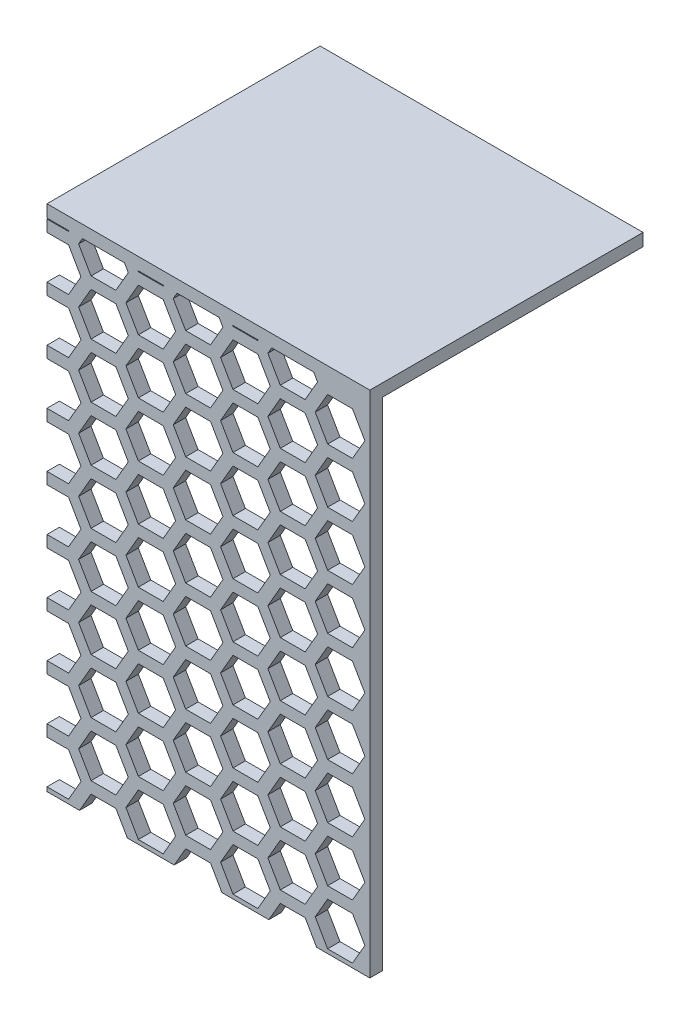
from build123d import *

# Parameters (mm, degrees)
SKETCH1_W                = 130
SKETCH1_H                = 205
BOSS_EXTRUDE1_DEPTH      = 5
CUT_EXTRUDE4_DEPTH       = 90
BOSS_EXTRUDE2_DEPTH      = 105
BOSS_EXTRUDE2_DEPTH_BACK = 5
SKETCH2_W                = 130
SKETCH2_H                = 5


with BuildPart() as part:
    # Sketch1 → Boss-Extrude1 (new body)
    with BuildSketch(Plane.XY):
        Rectangle(SKETCH1_W, SKETCH1_H)
    extrude(amount=BOSS_EXTRUDE1_DEPTH)

    # Sketch3 → Cut-Extrude4 (cut)
    with BuildSketch(Plane(origin=(0, 0, 5), x_dir=(-1, 0, 0), z_dir=(0, 0, -1))):
        Polygon((-43, 83.839745962), (-48, 92.5), (-58, 92.5), (-63, 83.839745962), (-58, 75.179491924), (-48, 75.179491924), align=None)
        Polygon((71.3153533, 149.839745962), (66.3153533, 158.5), (56.3153533, 158.5), (51.3153533, 149.839745962), (56.3153533, 141.179491924), (66.3153533, 141.179491924), align=None)
        Polygon((-23.947441117, 94.839745962), (-28.947441117, 103.5), (-38.947441117, 103.5), (-43.947441117, 94.839745962), (-38.947441117, 86.179491924), (-28.947441117, 86.179491924), align=None)
        Polygon((-4.894882233, 105.839745962), (-9.894882233, 114.5), (-19.894882233, 114.5), (-24.894882233, 105.839745962), (-19.894882233, 97.179491924), (-9.894882233, 97.179491924), align=None)
        Polygon((14.15767665, 116.839745962), (9.15767665, 125.5), (-0.84232335, 125.5), (-5.84232335, 116.839745962), (-0.84232335, 108.179491924), (9.15767665, 108.179491924), align=None)
        Polygon((33.210235533, 127.839745962), (28.210235533, 136.5), (18.210235533, 136.5), (13.210235533, 127.839745962), (18.210235533, 119.179491924), (28.210235533, 119.179491924), align=None)
        Polygon((52.262794416, 138.839745962), (47.262794416, 147.5), (37.262794416, 147.5), (32.262794416, 138.839745962), (37.262794416, 130.179491924), (47.262794416, 130.179491924), align=None)
        Polygon((-23.947441117, 72.839745962), (-28.947441117, 81.5), (-38.947441117, 81.5), (-43.947441117, 72.839745962), (-38.947441117, 64.179491924), (-28.947441117, 64.179491924), align=None)
        Polygon((-4.894882233, 83.839745962), (-9.894882233, 92.5), (-19.894882233, 92.5), (-24.894882233, 83.839745962), (-19.894882233, 75.179491924), (-9.894882233, 75.179491924), align=None)
        Polygon((14.15767665, 94.839745962), (9.15767665, 103.5), (-0.84232335, 103.5), (-5.84232335, 94.839745962), (-0.84232335, 86.179491924), (9.15767665, 86.179491924), align=None)
        Polygon((33.210235533, 105.839745962), (28.210235533, 114.5), (18.210235533, 114.5), (13.210235533, 105.839745962), (18.210235533, 97.179491924), (28.210235533, 97.179491924), align=None)
        Polygon((52.262794416, 116.839745962), (47.262794416, 125.5), (37.262794416, 125.5), (32.262794416, 116.839745962), (37.262794416, 108.179491924), (47.262794416, 108.179491924), align=None)
        Polygon((-23.947441117, 50.839745962), (-28.947441117, 59.5), (-38.947441117, 59.5), (-43.947441117, 50.839745962), (-38.947441117, 42.179491924), (-28.947441117, 42.179491924), align=None)
        Polygon((-4.894882233, 61.839745962), (-9.894882233, 70.5), (-19.894882233, 70.5), (-24.894882233, 61.839745962), (-19.894882233, 53.179491924), (-9.894882233, 53.179491924), align=None)
        Polygon((14.15767665, 72.839745962), (9.15767665, 81.5), (-0.84232335, 81.5), (-5.84232335, 72.839745962), (-0.84232335, 64.179491924), (9.15767665, 64.179491924), align=None)
        Polygon((33.210235533, 83.839745962), (28.210235533, 92.5), (18.210235533, 92.5), (13.210235533, 83.839745962), (18.210235533, 75.179491924), (28.210235533, 75.179491924), align=None)
        Polygon((52.262794416, 94.839745962), (47.262794416, 103.5), (37.262794416, 103.5), (32.262794416, 94.839745962), (37.262794416, 86.179491924), (47.262794416, 86.179491924), align=None)
        Polygon((-23.947441117, 28.839745962), (-28.947441117, 37.5), (-38.947441117, 37.5), (-43.947441117, 28.839745962), (-38.947441117, 20.179491924), (-28.947441117, 20.179491924), align=None)
        Polygon((-4.894882233, 39.839745962), (-9.894882233, 48.5), (-19.894882233, 48.5), (-24.894882233, 39.839745962), (-19.894882233, 31.179491924), (-9.894882233, 31.179491924), align=None)
        Polygon((14.15767665, 50.839745962), (9.15767665, 59.5), (-0.84232335, 59.5), (-5.84232335, 50.839745962), (-0.84232335, 42.179491924), (9.15767665, 42.179491924), align=None)
        Polygon((33.210235533, 61.839745962), (28.210235533, 70.5), (18.210235533, 70.5), (13.210235533, 61.839745962), (18.210235533, 53.179491924), (28.210235533, 53.179491924), align=None)
        Polygon((52.262794416, 72.839745962), (47.262794416, 81.5), (37.262794416, 81.5), (32.262794416, 72.839745962), (37.262794416, 64.179491924), (47.262794416, 64.179491924), align=None)
        Polygon((-23.947441117, 6.839745962), (-28.947441117, 15.5), (-38.947441117, 15.5), (-43.947441117, 6.839745962), (-38.947441117, -1.820508076), (-28.947441117, -1.820508076), align=None)
        Polygon((-4.894882233, 17.839745962), (-9.894882233, 26.5), (-19.894882233, 26.5), (-24.894882233, 17.839745962), (-19.894882233, 9.179491924), (-9.894882233, 9.179491924), align=None)
        Polygon((14.15767665, 28.839745962), (9.15767665, 37.5), (-0.84232335, 37.5), (-5.84232335, 28.839745962), (-0.84232335, 20.179491924), (9.15767665, 20.179491924), align=None)
        Polygon((33.210235533, 39.839745962), (28.210235533, 48.5), (18.210235533, 48.5), (13.210235533, 39.839745962), (18.210235533, 31.179491924), (28.210235533, 31.179491924), align=None)
        Polygon((52.262794416, 50.839745962), (47.262794416, 59.5), (37.262794416, 59.5), (32.262794416, 50.839745962), (37.262794416, 42.179491924), (47.262794416, 42.179491924), align=None)
        Polygon((-23.947441117, -15.160254038), (-28.947441117, -6.5), (-38.947441117, -6.5), (-43.947441117, -15.160254038), (-38.947441117, -23.820508076), (-28.947441117, -23.820508076), align=None)
        Polygon((-4.894882233, -4.160254038), (-9.894882233, 4.5), (-19.894882233, 4.5), (-24.894882233, -4.160254038), (-19.894882233, -12.820508076), (-9.894882233, -12.820508076), align=None)
        Polygon((14.15767665, 6.839745962), (9.15767665, 15.5), (-0.84232335, 15.5), (-5.84232335, 6.839745962), (-0.84232335, -1.820508076), (9.15767665, -1.820508076), align=None)
        Polygon((33.210235533, 17.839745962), (28.210235533, 26.5), (18.210235533, 26.5), (13.210235533, 17.839745962), (18.210235533, 9.179491924), (28.210235533, 9.179491924), align=None)
        Polygon((52.262794416, 28.839745962), (47.262794416, 37.5), (37.262794416, 37.5), (32.262794416, 28.839745962), (37.262794416, 20.179491924), (47.262794416, 20.179491924), align=None)
        Polygon((-23.947441117, -37.160254038), (-28.947441117, -28.5), (-38.947441117, -28.5), (-43.947441117, -37.160254038), (-38.947441117, -45.820508076), (-28.947441117, -45.820508076), align=None)
        Polygon((-4.894882233, -26.160254038), (-9.894882233, -17.5), (-19.894882233, -17.5), (-24.894882233, -26.160254038), (-19.894882233, -34.820508076), (-9.894882233, -34.820508076), align=None)
        Polygon((14.15767665, -15.160254038), (9.15767665, -6.5), (-0.84232335, -6.5), (-5.84232335, -15.160254038), (-0.84232335, -23.820508076), (9.15767665, -23.820508076), align=None)
        Polygon((33.210235533, -4.160254038), (28.210235533, 4.5), (18.210235533, 4.5), (13.210235533, -4.160254038), (18.210235533, -12.820508076), (28.210235533, -12.820508076), align=None)
        Polygon((52.262794416, 6.839745962), (47.262794416, 15.5), (37.262794416, 15.5), (32.262794416, 6.839745962), (37.262794416, -1.820508076), (47.262794416, -1.820508076), align=None)
        Polygon((-23.947441117, -59.160254038), (-28.947441117, -50.5), (-38.947441117, -50.5), (-43.947441117, -59.160254038), (-38.947441117, -67.820508076), (-28.947441117, -67.820508076), align=None)
        Polygon((-4.894882233, -48.160254038), (-9.894882233, -39.5), (-19.894882233, -39.5), (-24.894882233, -48.160254038), (-19.894882233, -56.820508076), (-9.894882233, -56.820508076), align=None)
        Polygon((14.15767665, -37.160254038), (9.15767665, -28.5), (-0.84232335, -28.5), (-5.84232335, -37.160254038), (-0.84232335, -45.820508076), (9.15767665, -45.820508076), align=None)
        Polygon((33.210235533, -26.160254038), (28.210235533, -17.5), (18.210235533, -17.5), (13.210235533, -26.160254038), (18.210235533, -34.820508076), (28.210235533, -34.820508076), align=None)
        Polygon((52.262794416, -15.160254038), (47.262794416, -6.5), (37.262794416, -6.5), (32.262794416, -15.160254038), (37.262794416, -23.820508076), (47.262794416, -23.820508076), align=None)
        Polygon((-23.947441117, -81.160254038), (-28.947441117, -72.5), (-38.947441117, -72.5), (-43.947441117, -81.160254038), (-38.947441117, -89.820508075), (-28.947441117, -89.820508075), align=None)
        Polygon((-4.894882233, -70.160254038), (-9.894882233, -61.5), (-19.894882233, -61.5), (-24.894882233, -70.160254038), (-19.894882233, -78.820508075), (-9.894882233, -78.820508075), align=None)
        Polygon((14.15767665, -59.160254038), (9.15767665, -50.5), (-0.84232335, -50.5), (-5.84232335, -59.160254038), (-0.84232335, -67.820508075), (9.15767665, -67.820508075), align=None)
        Polygon((33.210235533, -48.160254038), (28.210235533, -39.5), (18.210235533, -39.5), (13.210235533, -48.160254038), (18.210235533, -56.820508075), (28.210235533, -56.820508075), align=None)
        Polygon((52.262794416, -37.160254038), (47.262794416, -28.5), (37.262794416, -28.5), (32.262794416, -37.160254038), (37.262794416, -45.820508075), (47.262794416, -45.820508075), align=None)
        Polygon((-23.947441117, -103.160254038), (-28.947441117, -94.5), (-38.947441117, -94.5), (-43.947441117, -103.160254038), (-38.947441117, -111.820508075), (-28.947441117, -111.820508075), align=None)
        Polygon((-4.894882233, -92.160254038), (-9.894882233, -83.5), (-19.894882233, -83.5), (-24.894882233, -92.160254038), (-19.894882233, -100.820508075), (-9.894882233, -100.820508075), align=None)
        Polygon((14.15767665, -81.160254038), (9.15767665, -72.5), (-0.84232335, -72.5), (-5.84232335, -81.160254038), (-0.84232335, -89.820508075), (9.15767665, -89.820508075), align=None)
        Polygon((33.210235533, -70.160254038), (28.210235533, -61.5), (18.210235533, -61.5), (13.210235533, -70.160254038), (18.210235533, -78.820508075), (28.210235533, -78.820508075), align=None)
        Polygon((52.262794416, -59.160254038), (47.262794416, -50.5), (37.262794416, -50.5), (32.262794416, -59.160254038), (37.262794416, -67.820508075), (47.262794416, -67.820508075), align=None)
        Polygon((-23.947441117, -125.160254038), (-28.947441117, -116.5), (-38.947441117, -116.5), (-43.947441117, -125.160254038), (-38.947441117, -133.820508075), (-28.947441117, -133.820508075), align=None)
        Polygon((-4.894882233, -114.160254038), (-9.894882233, -105.5), (-19.894882233, -105.5), (-24.894882233, -114.160254038), (-19.894882233, -122.820508075), (-9.894882233, -122.820508075), align=None)
        Polygon((14.15767665, -103.160254038), (9.15767665, -94.5), (-0.84232335, -94.5), (-5.84232335, -103.160254038), (-0.84232335, -111.820508075), (9.15767665, -111.820508075), align=None)
        Polygon((33.210235533, -92.160254038), (28.210235533, -83.5), (18.210235533, -83.5), (13.210235533, -92.160254038), (18.210235533, -100.820508075), (28.210235533, -100.820508075), align=None)
        Polygon((52.262794416, -81.160254038), (47.262794416, -72.5), (37.262794416, -72.5), (32.262794416, -81.160254038), (37.262794416, -89.820508075), (47.262794416, -89.820508075), align=None)
        Polygon((-23.947441117, -147.160254038), (-28.947441117, -138.5), (-38.947441117, -138.5), (-43.947441117, -147.160254038), (-38.947441117, -155.820508075), (-28.947441117, -155.820508075), align=None)
        Polygon((-4.894882233, -136.160254038), (-9.894882233, -127.5), (-19.894882233, -127.5), (-24.894882233, -136.160254038), (-19.894882233, -144.820508075), (-9.894882233, -144.820508075), align=None)
        Polygon((14.15767665, -125.160254038), (9.15767665, -116.5), (-0.84232335, -116.5), (-5.84232335, -125.160254038), (-0.84232335, -133.820508075), (9.15767665, -133.820508075), align=None)
        Polygon((33.210235533, -114.160254038), (28.210235533, -105.5), (18.210235533, -105.5), (13.210235533, -114.160254038), (18.210235533, -122.820508075), (28.210235533, -122.820508075), align=None)
        Polygon((52.262794416, -103.160254038), (47.262794416, -94.5), (37.262794416, -94.5), (32.262794416, -103.160254038), (37.262794416, -111.820508075), (47.262794416, -111.820508075), align=None)
        Polygon((-43, 61.839745962), (-48, 70.5), (-58, 70.5), (-63, 61.839745962), (-58, 53.179491924), (-48, 53.179491924), align=None)
        Polygon((-43, 39.839745962), (-48, 48.5), (-58, 48.5), (-63, 39.839745962), (-58, 31.179491924), (-48, 31.179491924), align=None)
        Polygon((-43, 17.839745962), (-48, 26.5), (-58, 26.5), (-63, 17.839745962), (-58, 9.179491924), (-48, 9.179491924), align=None)
        Polygon((-43, -4.160254038), (-48, 4.5), (-58, 4.5), (-63, -4.160254038), (-58, -12.820508076), (-48, -12.820508076), align=None)
        Polygon((-43, -26.160254038), (-48, -17.5), (-58, -17.5), (-63, -26.160254038), (-58, -34.820508076), (-48, -34.820508076), align=None)
        Polygon((-43, -48.160254038), (-48, -39.5), (-58, -39.5), (-63, -48.160254038), (-58, -56.820508076), (-48, -56.820508076), align=None)
        Polygon((-43, -70.160254038), (-48, -61.5), (-58, -61.5), (-63, -70.160254038), (-58, -78.820508076), (-48, -78.820508076), align=None)
        Polygon((-43, -92.160254038), (-48, -83.5), (-58, -83.5), (-63, -92.160254038), (-58, -100.820508075), (-48, -100.820508075), align=None)
        Polygon((-43, -114.160254038), (-48, -105.5), (-58, -105.5), (-63, -114.160254038), (-58, -122.820508075), (-48, -122.820508075), align=None)
        Polygon((-43, -136.160254038), (-48, -127.5), (-58, -127.5), (-63, -136.160254038), (-58, -144.820508075), (-48, -144.820508075), align=None)
        Polygon((-43, -158.160254038), (-48, -149.5), (-58, -149.5), (-63, -158.160254038), (-58, -166.820508075), (-48, -166.820508075), align=None)
        Polygon((71.3153533, 127.839745962), (66.3153533, 136.5), (56.3153533, 136.5), (51.3153533, 127.839745962), (56.3153533, 119.179491924), (66.3153533, 119.179491924), align=None)
        Polygon((71.3153533, 105.839745962), (66.3153533, 114.5), (56.3153533, 114.5), (51.3153533, 105.839745962), (56.3153533, 97.179491924), (66.3153533, 97.179491924), align=None)
        Polygon((71.3153533, 83.839745962), (66.3153533, 92.5), (56.3153533, 92.5), (51.3153533, 83.839745962), (56.3153533, 75.179491924), (66.3153533, 75.179491924), align=None)
        Polygon((71.3153533, 61.839745962), (66.3153533, 70.5), (56.3153533, 70.5), (51.3153533, 61.839745962), (56.3153533, 53.179491924), (66.3153533, 53.179491924), align=None)
        Polygon((71.3153533, 39.839745962), (66.3153533, 48.5), (56.3153533, 48.5), (51.3153533, 39.839745962), (56.3153533, 31.179491924), (66.3153533, 31.179491924), align=None)
        Polygon((71.3153533, 17.839745962), (66.3153533, 26.5), (56.3153533, 26.5), (51.3153533, 17.839745962), (56.3153533, 9.179491924), (66.3153533, 9.179491924), align=None)
        Polygon((71.3153533, -4.160254038), (66.3153533, 4.5), (56.3153533, 4.5), (51.3153533, -4.160254038), (56.3153533, -12.820508076), (66.3153533, -12.820508076), align=None)
        Polygon((71.3153533, -26.160254038), (66.3153533, -17.5), (56.3153533, -17.5), (51.3153533, -26.160254038), (56.3153533, -34.820508075), (66.3153533, -34.820508075), align=None)
        Polygon((71.3153533, -48.160254038), (66.3153533, -39.5), (56.3153533, -39.5), (51.3153533, -48.160254038), (56.3153533, -56.820508075), (66.3153533, -56.820508075), align=None)
        Polygon((71.3153533, -70.160254038), (66.3153533, -61.5), (56.3153533, -61.5), (51.3153533, -70.160254038), (56.3153533, -78.820508075), (66.3153533, -78.820508075), align=None)
        Polygon((71.3153533, -92.160254038), (66.3153533, -83.5), (56.3153533, -83.5), (51.3153533, -92.160254038), (56.3153533, -100.820508075), (66.3153533, -100.820508075), align=None)
    extrude(amount=CUT_EXTRUDE4_DEPTH, mode=Mode.SUBTRACT)

    # Sketch2 → Boss-Extrude2 (add, two sides: drawn at the far end of the back side and taken through both)
    with BuildSketch(Plane(origin=(0, 0, 0), x_dir=(-1, 0, 0), z_dir=(0, 0, -1)).offset(-BOSS_EXTRUDE2_DEPTH_BACK)):
        with Locations((0, 100)):
            Rectangle(SKETCH2_W, SKETCH2_H)
    extrude(amount=BOSS_EXTRUDE2_DEPTH + BOSS_EXTRUDE2_DEPTH_BACK)


solid = part.part
